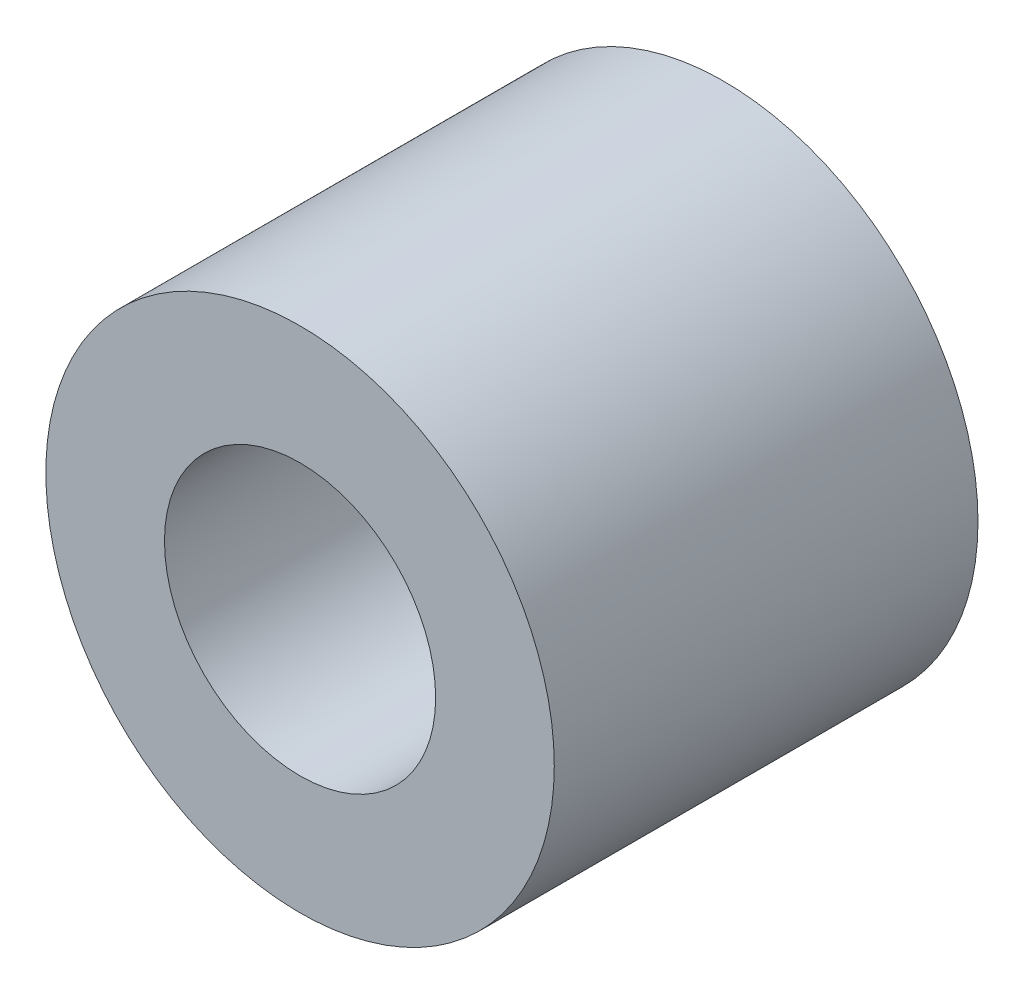
from build123d import *

# Parameters (mm, degrees)
SKETCH1_R      = 3
SKETCH1_R_2    = 1.6
EXTRUDE1_DEPTH = 2.5


with BuildPart() as part:
    # Sketch1 → Extrude1 (new, symmetric)
    with BuildSketch(Plane.XY):
        Circle(SKETCH1_R)
        Circle(SKETCH1_R_2, mode=Mode.SUBTRACT)
    extrude(amount=EXTRUDE1_DEPTH, both=True)


solid = part.part
